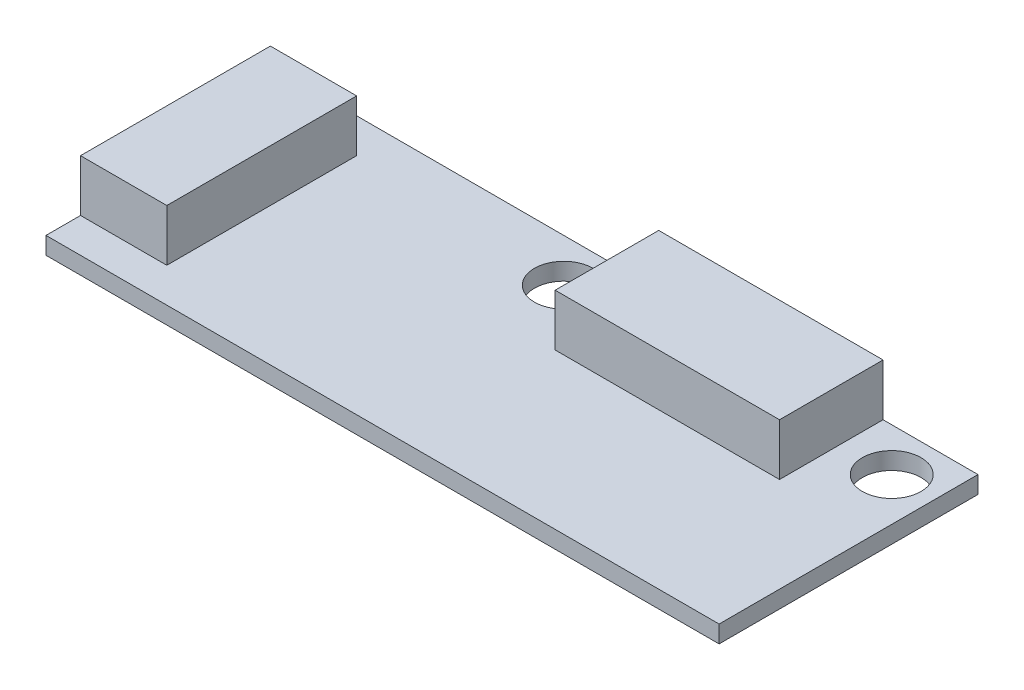
from build123d import *

# Parameters (mm, degrees)
SKETCH1_W            = 39
SKETCH1_H            = 15
BOSS_EXTRUDE1_DEPTH  = 1
M3_CLEARANCE_HOLE1_D = 3.4
SKETCH4_W            = 13
SKETCH4_H            = 6
BOSS_EXTRUDE2_DEPTH  = 3
SKETCH5_W            = 5
SKETCH5_H            = 11
BOSS_EXTRUDE3_DEPTH  = 3


with BuildPart() as part:
    # Sketch1 → Boss-Extrude1 (new body)
    with BuildSketch(Plane(origin=(0, 0, 0), x_dir=(1, 0, 0), z_dir=(0, 1, 0))):
        with Locations((19.5, 7.5)):
            Rectangle(SKETCH1_W, SKETCH1_H)
    extrude(amount=BOSS_EXTRUDE1_DEPTH)

    # M3 Clearance Hole1 (through all)
    with Locations(Plane(origin=(0, 1, 0), x_dir=(1, 0, 0), z_dir=(0, 1, 0))):
        with Locations((36.5, 12.5), (17.5, 12.5)):
            Hole(M3_CLEARANCE_HOLE1_D / 2)

    # Sketch4 → Boss-Extrude2 (add)
    with BuildSketch(Plane(origin=(0, 1, 0), x_dir=(1, 0, 0), z_dir=(0, 1, 0))):
        with Locations((27, 12)):
            Rectangle(SKETCH4_W, SKETCH4_H)
    extrude(amount=BOSS_EXTRUDE2_DEPTH)

    # Sketch5 → Boss-Extrude3 (add)
    with BuildSketch(Plane(origin=(0, 1, 0), x_dir=(1, 0, 0), z_dir=(0, 1, 0))):
        with Locations((2.5, 7.5)):
            Rectangle(SKETCH5_W, SKETCH5_H)
    extrude(amount=BOSS_EXTRUDE3_DEPTH)


solid = part.part
